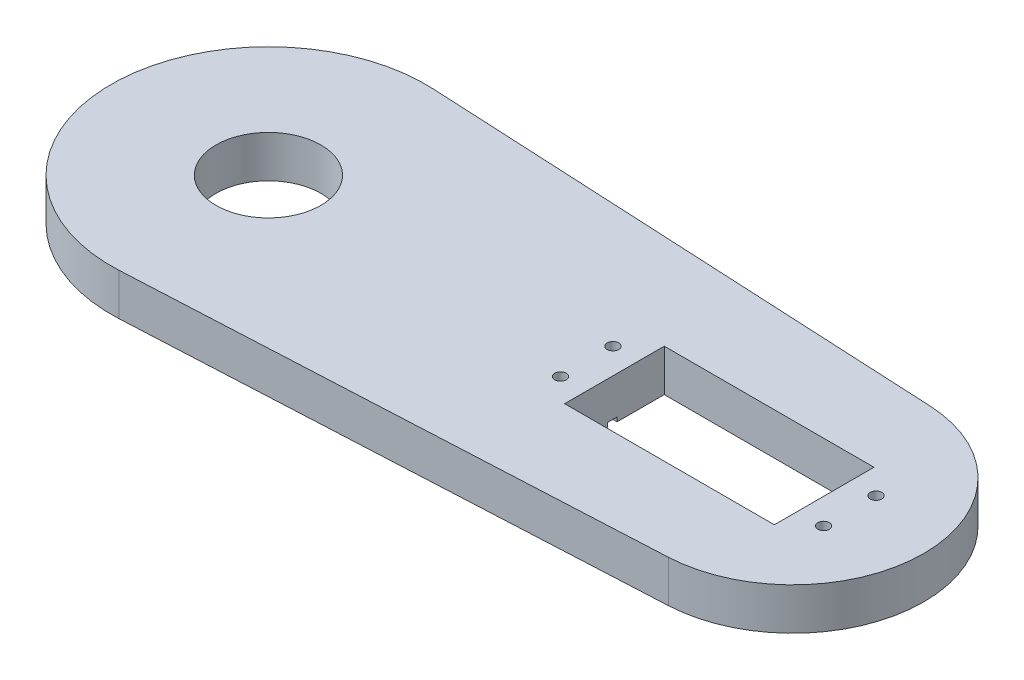
from build123d import *

# Parameters (mm, degrees)
CROQUIS1_R              = 1.1
CROQUIS1_R_2            = 0.8
CROQUIS1_W              = 40
CROQUIS1_H              = 19
SALIENTE_EXTRUIR1_DEPTH = 8
CROQUIS3_W              = 7
CROQUIS3_H              = 1.8
CORTAR_EXTRUIR2_DEPTH   = 0.8
CROQUIS2_R              = 10
CORTAR_EXTRUIR4_DEPTH   = 129.798291914


with BuildPart() as part:
    # Croquis1 → Saliente-Extruir1 (new body)
    with BuildSketch(Plane(origin=(0, 0, 0), x_dir=(1, 0, 0), z_dir=(0, 1, 0))):
        with BuildLine():
            Line((1.5, 29.962476533), (101.25, 24.968730444))
            ThreePointArc((101.25, 24.968730444), (125, 0), (101.25, -24.968730444))
            Line((101.25, -24.968730444), (1.5, -29.962476533))
            ThreePointArc((1.5, -29.962476533), (-30, 0), (1.5, 29.962476533))
        make_face()
        with Locations(Location((110.89, 5, 0), (0, 0, 270))):
            Circle(CROQUIS1_R, mode=Mode.SUBTRACT)
        with Locations(Location((110.89, -5, 0), (0, 0, 270))):
            Circle(CROQUIS1_R, mode=Mode.SUBTRACT)
        with Locations(Location((61.111607097, -5.4, 0), (0, 0, 270))):
            Circle(CROQUIS1_R, mode=Mode.SUBTRACT)
        with Locations(Location((61.111607097, 4.6, 0), (0, 0, 270))):
            Circle(CROQUIS1_R, mode=Mode.SUBTRACT)
        with Locations(Location((7.5, 0, 0), (0, 0, 270))):
            Circle(CROQUIS1_R_2, mode=Mode.SUBTRACT)
        with Locations(Location((0, -7.5, 0), (0, 0, 270))):
            Circle(CROQUIS1_R_2, mode=Mode.SUBTRACT)
        with Locations(Location((-7.5, 0, 0), (0, 0, 270))):
            Circle(CROQUIS1_R_2, mode=Mode.SUBTRACT)
        with Locations(Location((0, 7.5, 0), (0, 0, 270))):
            Circle(CROQUIS1_R_2, mode=Mode.SUBTRACT)
        with Locations(Location((0, 0, 0), (0, 0, 270))):
            Circle(CROQUIS1_R_2, mode=Mode.SUBTRACT)
        with Locations((86, 0)):
            Rectangle(CROQUIS1_W, CROQUIS1_H, mode=Mode.SUBTRACT)
    extrude(amount=SALIENTE_EXTRUIR1_DEPTH)

    # Croquis3 → Cortar-Extruir2 (cut)
    with BuildSketch(Plane.XZ):
        with Locations((62.5, 0.4)):
            Rectangle(CROQUIS3_W, CROQUIS3_H)
        with Locations((109.5, 0.4)):
            Rectangle(CROQUIS3_W, CROQUIS3_H)
    extrude(amount=-CORTAR_EXTRUIR2_DEPTH, mode=Mode.SUBTRACT)

    # Croquis2 → Cortar-Extruir4 (cut, through all)
    with BuildSketch(Plane.XZ):
        with Locations(Location((0, 0, 0), (0, 0, 270))):
            Circle(CROQUIS2_R)
    extrude(amount=-CORTAR_EXTRUIR4_DEPTH, mode=Mode.SUBTRACT)


solid = part.part
